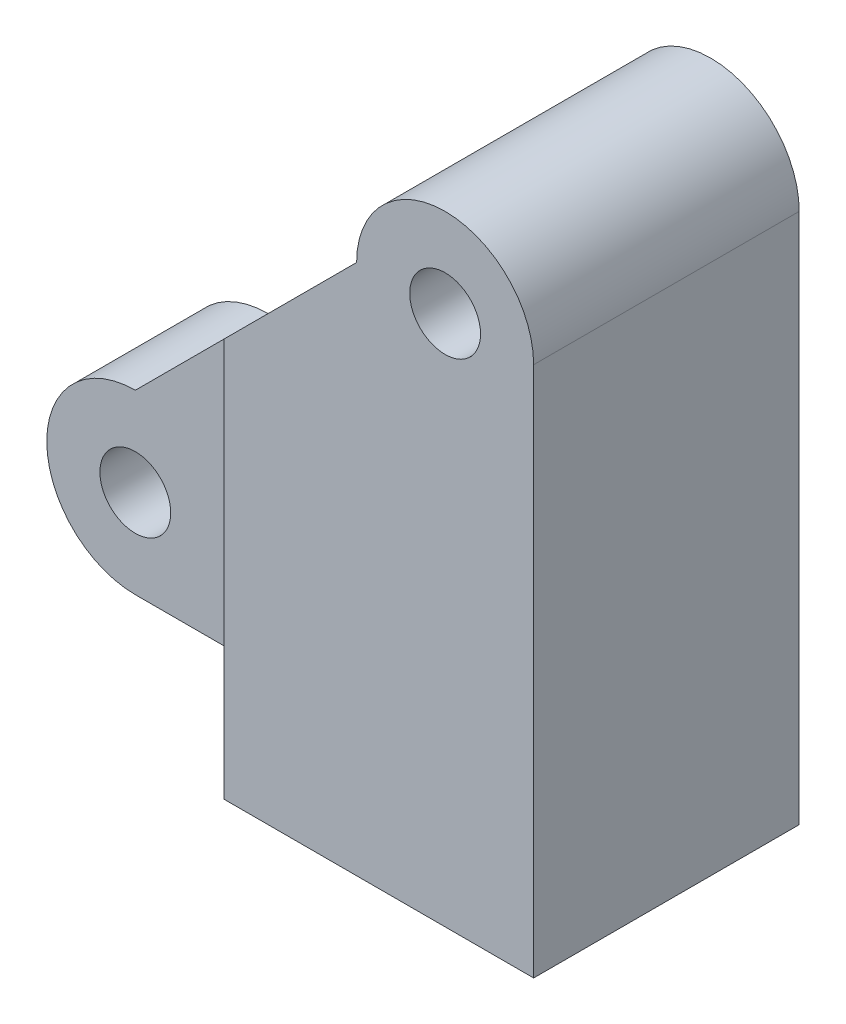
from build123d import *

# Parameters (mm, degrees)
SKETCH1_R           = 4
BOSS_EXTRUDE1_DEPTH = 30
CUT_EXTRUDE3_START  = -15
CUT_EXTRUDE3_DEPTH  = 15
ECHELLE1_SCALE      = 0.6


with BuildPart() as part:
    # Sketch1 → Boss-Extrude1 (new body)
    with BuildSketch(Plane.XY):
        with BuildLine():
            Line((0, -10), (60, -10))
            Line((60, -10), (60, 50))
            ThreePointArc((60, 50), (50, 60), (40, 50))
            Line((40, 50), (0, 10))
            ThreePointArc((0, 10), (-10, 0), (0, -10))
        make_face()
        with Locations((50, 50)):
            Circle(SKETCH1_R, mode=Mode.SUBTRACT)
        Circle(SKETCH1_R, mode=Mode.SUBTRACT)
    extrude(amount=BOSS_EXTRUDE1_DEPTH)

    # Sketch3 → Cut-Extrude3 (cut)
    with BuildSketch(Plane.XY.offset(30).offset(CUT_EXTRUDE3_START)):
        with BuildLine():
            Line((60, -217.989898732), (60, -10))
            Line((60, -10), (60, 50))
            ThreePointArc((60, 50), (50, 60), (40, 50))
            Line((40, 50), (0, 10))
            ThreePointArc((0, 10), (-10, 0), (0, -10))
            Line((0, -10), (60, -10))
            Line((60, -10), (25, -10))
            Line((25, -10), (25, 35))
            Line((25, 35), (25, 242.989898732))
            Line((25, 242.989898732), (-389.785969286, 211.497176047))
            Line((-389.785969286, 211.497176047), (-354.785969286, -249.482621417))
            Line((-354.785969286, -249.482621417), (60, -217.989898732))
        make_face()
    extrude(amount=CUT_EXTRUDE3_DEPTH, mode=Mode.SUBTRACT)


with BuildPart() as part_1:
    # Echelle1: scaled about (37.827967632, 17.936559761, 13.650169575)
    add(part.part.scale(ECHELLE1_SCALE).moved(Location((15.131187053, 7.174623904, 5.46006783))))


solid = part_1.part
